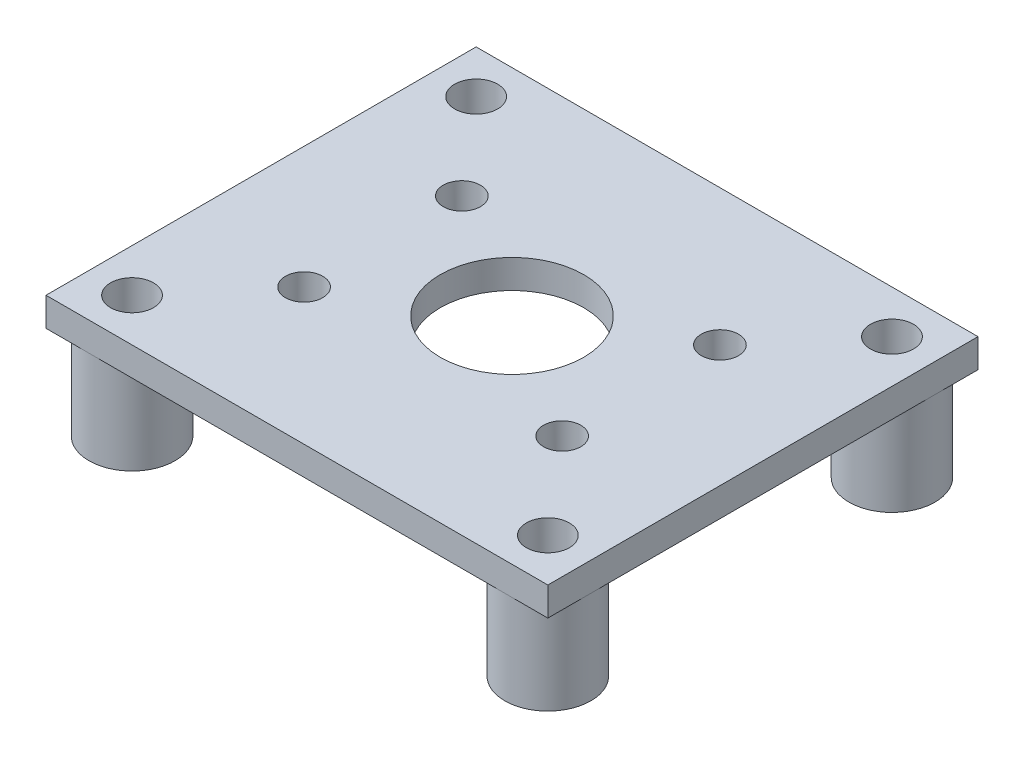
from build123d import *

# Parameters (mm, degrees)
SKETCH1_W           = 35
SKETCH1_H           = 30
BOSS_EXTRUDE1_DEPTH = 2
CUT_EXTRUDE1_REACH  = 25.135
SKETCH2_R           = 1.3
CUT_EXTRUDE2_REACH  = 25.135
SKETCH3_R           = 1.5
SKETCH4_R           = 3
BOSS_EXTRUDE2_DEPTH = 6.5
CUT_EXTRUDE3_REACH  = 25.948
SKETCH5_R           = 1.5
SKETCH7_R           = 5
CUT_EXTRUDE4_DEPTH  = 3


with BuildPart() as part:
    # Sketch1 → Boss-Extrude1 (new body)
    with BuildSketch(Plane(origin=(0, 0, 0), x_dir=(1, 0, 0), z_dir=(0, 1, 0))):
        Rectangle(SKETCH1_W, SKETCH1_H)
    extrude(amount=BOSS_EXTRUDE1_DEPTH)

    # Sketch2 → Cut-Extrude1 (cut, up to next)
    with BuildSketch(Plane(origin=(0, 2, 0), x_dir=(1, 0, 0), z_dir=(0, 1, 0)), mode=Mode.PRIVATE) as cut_extrude1_sk1:
        with Locations(Location((9, 5.5, 0), (0, 0, 270))):
            Circle(SKETCH2_R)
    cut_extrude1_tool1 = extrude(cut_extrude1_sk1.sketch, amount=-CUT_EXTRUDE1_REACH, mode=Mode.PRIVATE) & part.part
    # Sketch2 → Cut-Extrude1 (cut, up to next)
    with BuildSketch(Plane(origin=(0, 2, 0), x_dir=(1, 0, 0), z_dir=(0, 1, 0)), mode=Mode.PRIVATE) as cut_extrude1_sk2:
        with Locations(Location((-9, 5.5, 0), (0, 0, 270))):
            Circle(SKETCH2_R)
    cut_extrude1_tool2 = extrude(cut_extrude1_sk2.sketch, amount=-CUT_EXTRUDE1_REACH, mode=Mode.PRIVATE) & part.part
    # Sketch2 → Cut-Extrude1 (cut, up to next)
    with BuildSketch(Plane(origin=(0, 2, 0), x_dir=(1, 0, 0), z_dir=(0, 1, 0)), mode=Mode.PRIVATE) as cut_extrude1_sk3:
        with Locations(Location((9, -5.5, 0), (0, 0, 270))):
            Circle(SKETCH2_R)
    cut_extrude1_tool3 = extrude(cut_extrude1_sk3.sketch, amount=-CUT_EXTRUDE1_REACH, mode=Mode.PRIVATE) & part.part
    # Sketch2 → Cut-Extrude1 (cut, up to next)
    with BuildSketch(Plane(origin=(0, 2, 0), x_dir=(1, 0, 0), z_dir=(0, 1, 0)), mode=Mode.PRIVATE) as cut_extrude1_sk4:
        with Locations(Location((-9, -5.5, 0), (0, 0, 270))):
            Circle(SKETCH2_R)
    cut_extrude1_tool4 = extrude(cut_extrude1_sk4.sketch, amount=-CUT_EXTRUDE1_REACH, mode=Mode.PRIVATE) & part.part
    add(cut_extrude1_tool1.solids().sort_by_distance((9, 2, -5.5))[0], mode=Mode.SUBTRACT)
    add(cut_extrude1_tool2.solids().sort_by_distance((-9, 2, -5.5))[0], mode=Mode.SUBTRACT)
    add(cut_extrude1_tool3.solids().sort_by_distance((9, 2, 5.5))[0], mode=Mode.SUBTRACT)
    add(cut_extrude1_tool4.solids().sort_by_distance((-9, 2, 5.5))[0], mode=Mode.SUBTRACT)

    # Sketch3 → Cut-Extrude2 (cut, up to next)
    with BuildSketch(Plane.XZ, mode=Mode.PRIVATE) as cut_extrude2_sk1:
        with Locations(Location((-14.5, 12, 0), (0, 0, 270))):
            Circle(SKETCH3_R)
    cut_extrude2_tool1 = extrude(cut_extrude2_sk1.sketch, amount=-CUT_EXTRUDE2_REACH, mode=Mode.PRIVATE) & part.part
    # Sketch3 → Cut-Extrude2 (cut, up to next)
    with BuildSketch(Plane.XZ, mode=Mode.PRIVATE) as cut_extrude2_sk2:
        with Locations(Location((14.5, 12, 0), (0, 0, 270))):
            Circle(SKETCH3_R)
    cut_extrude2_tool2 = extrude(cut_extrude2_sk2.sketch, amount=-CUT_EXTRUDE2_REACH, mode=Mode.PRIVATE) & part.part
    # Sketch3 → Cut-Extrude2 (cut, up to next)
    with BuildSketch(Plane.XZ, mode=Mode.PRIVATE) as cut_extrude2_sk3:
        with Locations(Location((14.5, -12, 0), (0, 0, 90))):
            Circle(SKETCH3_R)
    cut_extrude2_tool3 = extrude(cut_extrude2_sk3.sketch, amount=-CUT_EXTRUDE2_REACH, mode=Mode.PRIVATE) & part.part
    # Sketch3 → Cut-Extrude2 (cut, up to next)
    with BuildSketch(Plane.XZ, mode=Mode.PRIVATE) as cut_extrude2_sk4:
        with Locations(Location((-14.5, -12, 0), (0, 0, 90))):
            Circle(SKETCH3_R)
    cut_extrude2_tool4 = extrude(cut_extrude2_sk4.sketch, amount=-CUT_EXTRUDE2_REACH, mode=Mode.PRIVATE) & part.part
    add(cut_extrude2_tool1.solids().sort_by_distance((-14.5, 0, 12))[0], mode=Mode.SUBTRACT)
    add(cut_extrude2_tool2.solids().sort_by_distance((14.5, 0, 12))[0], mode=Mode.SUBTRACT)
    add(cut_extrude2_tool3.solids().sort_by_distance((14.5, 0, -12))[0], mode=Mode.SUBTRACT)
    add(cut_extrude2_tool4.solids().sort_by_distance((-14.5, 0, -12))[0], mode=Mode.SUBTRACT)

    # Sketch4 → Boss-Extrude2 (add)
    with BuildSketch(Plane.XZ):
        with Locations(Location((-14.5, 12, 0), (0, 0, 90))):
            Circle(SKETCH4_R)
        with Locations(Location((14.5, 12, 0), (0, 0, 90))):
            Circle(SKETCH4_R)
        with Locations(Location((-14.5, -12, 0), (0, 0, 270))):
            Circle(SKETCH4_R)
        with Locations(Location((14.5, -12, 0), (0, 0, 270))):
            Circle(SKETCH4_R)
    extrude(amount=BOSS_EXTRUDE2_DEPTH)

    # Sketch5 → Cut-Extrude3 (cut, up to next)
    with BuildSketch(Plane(origin=(0, 0, 0), x_dir=(1, 0, 0), z_dir=(0, 1, 0)), mode=Mode.PRIVATE) as cut_extrude3_sk1:
        with Locations(Location((-14.5, 12, 0), (0, 0, 90))):
            Circle(SKETCH5_R)
    cut_extrude3_tool1 = extrude(cut_extrude3_sk1.sketch, amount=-CUT_EXTRUDE3_REACH, mode=Mode.PRIVATE) & part.part
    # Sketch5 → Cut-Extrude3 (cut, up to next)
    with BuildSketch(Plane(origin=(0, 0, 0), x_dir=(1, 0, 0), z_dir=(0, 1, 0)), mode=Mode.PRIVATE) as cut_extrude3_sk2:
        with Locations(Location((14.5, 12, 0), (0, 0, 90))):
            Circle(SKETCH5_R)
    cut_extrude3_tool2 = extrude(cut_extrude3_sk2.sketch, amount=-CUT_EXTRUDE3_REACH, mode=Mode.PRIVATE) & part.part
    # Sketch5 → Cut-Extrude3 (cut, up to next)
    with BuildSketch(Plane(origin=(0, 0, 0), x_dir=(1, 0, 0), z_dir=(0, 1, 0)), mode=Mode.PRIVATE) as cut_extrude3_sk3:
        with Locations(Location((14.5, -12, 0), (0, 0, 90))):
            Circle(SKETCH5_R)
    cut_extrude3_tool3 = extrude(cut_extrude3_sk3.sketch, amount=-CUT_EXTRUDE3_REACH, mode=Mode.PRIVATE) & part.part
    # Sketch5 → Cut-Extrude3 (cut, up to next)
    with BuildSketch(Plane(origin=(0, 0, 0), x_dir=(1, 0, 0), z_dir=(0, 1, 0)), mode=Mode.PRIVATE) as cut_extrude3_sk4:
        with Locations(Location((-14.5, -12, 0), (0, 0, 90))):
            Circle(SKETCH5_R)
    cut_extrude3_tool4 = extrude(cut_extrude3_sk4.sketch, amount=-CUT_EXTRUDE3_REACH, mode=Mode.PRIVATE) & part.part
    add(cut_extrude3_tool1.solids().sort_by_distance((-14.5, 0, -12))[0], mode=Mode.SUBTRACT)
    add(cut_extrude3_tool2.solids().sort_by_distance((14.5, 0, -12))[0], mode=Mode.SUBTRACT)
    add(cut_extrude3_tool3.solids().sort_by_distance((14.5, 0, 12))[0], mode=Mode.SUBTRACT)
    add(cut_extrude3_tool4.solids().sort_by_distance((-14.5, 0, 12))[0], mode=Mode.SUBTRACT)

    # Sketch7 → Cut-Extrude4 (cut)
    with BuildSketch(Plane(origin=(0, 2, 0), x_dir=(1, 0, 0), z_dir=(0, 1, 0))):
        with Locations(Location((0, 0, 0), (0, 0, 270))):
            Circle(SKETCH7_R)
    extrude(amount=-CUT_EXTRUDE4_DEPTH, mode=Mode.SUBTRACT)


solid = part.part
